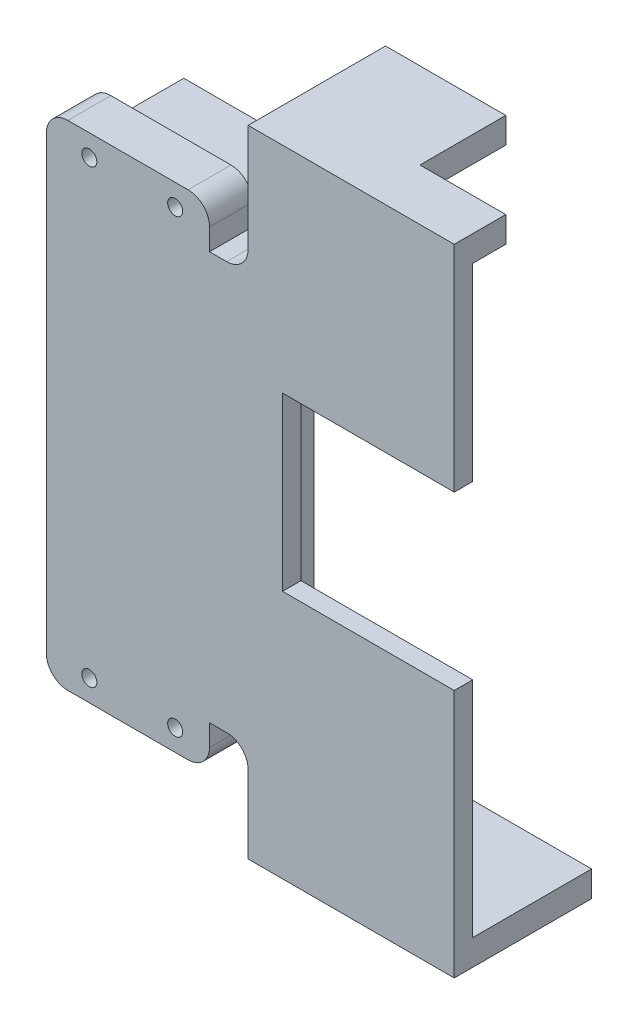
from build123d import *

# Parameters (mm, degrees)
SKETCH_1_W                = 130
SKETCH_1_H                = 64
EXTRUDE_1_DEPTH           = 125
SKETCH_2_W                = 55.4
SKETCH_2_H                = 114
CUT_EXTRUDE_1_DEPTH       = 47
SKETCH_3_W                = 45.4
SKETCH_3_H                = 86
CUT_EXTRUDE_2_DEPTH       = 78
SKETCH_4_W                = 24.038907643
SKETCH_4_H                = 40
CUT_EXTRUDE_3_DEPTH       = 40
SKETCH_5_W                = 4.3
SKETCH_5_H                = 25
CUT_EXTRUDE_4_DEPTH       = 25
SKETCH_6_W                = 10
SKETCH_6_H                = 40
CUT_EXTRUDE_5_DEPTH       = 35
SKETCH_9_W                = 5
SKETCH_9_H                = 125
CUT_EXTRUDE_8_DEPTH       = 155.744951452
SKETCH_10_W               = 20
SKETCH_10_H               = 150
EXTRUDE_2_DEPTH           = 5
SKETCH_11_R               = 2.5
CUT_EXTRUDE_9_DEPTH       = 159.941026799
FILLET_1_R                = 3
SKETCH_12_W               = 32
SKETCH_12_H               = 30
CUT_EXTRUDE_10_DEPTH      = 161.864073055
SKETCH_13_W               = 45
SKETCH_13_H               = 50
CUT_EXTRUDE_11_DEPTH      = 30
FILLET_5_R                = 5
SKETCH_14_W               = 32
SKETCH_14_H               = 150
CUT_EXTRUDE_12_DEPTH      = 185.946613919
SKETCH_16_W               = 14.899109585
SKETCH_16_H               = 40
CUT_EXTRUDE_14_DEPTH      = 40
CUT_EXTRUDE_15_DEPTH      = 143.707007536
CUT_EXTRUDE_15_DEPTH_BACK = 143.707007536
SKETCH_17_W               = 30
SKETCH_17_H               = 95
SKETCH_18_W               = 20
SKETCH_18_H               = 6
CUT_EXTRUDE_16_DEPTH      = 150.244765402
SKETCH_20_W               = 47
SKETCH_20_H               = 10
EXTRUDE_3_DEPTH           = 10
SKETCH_21_R               = 1.75
CUT_EXTRUDE_17_DEPTH      = 141.388745988
SKETCH_23_W               = 42
SKETCH_23_H               = 27.7
CUT_EXTRUDE_19_DEPTH      = 138.927517197
EXTRUDE_4_DEPTH           = 27.7
SKETCH_25_W               = 48
SKETCH_25_H               = 23
EXTRUDE_5_DEPTH           = 4.3
FILLET_6_R                = 5
FILLET_8_R                = 5
CUT_EXTRUDE_23_DEPTH      = 10
SKETCH_31_R               = 1.55
CUT_EXTRUDE_24_DEPTH      = 138.669895039
FILLET_9_R                = 5
FILLET_10_R               = 5
FILLET_11_R               = 5


with BuildPart() as part:
    # 草图1 → 凸台-拉伸1 (new body)
    with BuildSketch(Plane(origin=(0, 0, 0), x_dir=(1, 0, 0), z_dir=(0, 1, 0))):
        Rectangle(SKETCH_1_W, SKETCH_1_H)
    extrude(amount=EXTRUDE_1_DEPTH)

    # 草图2 → 切除-拉伸1 (cut)
    with BuildSketch(Plane(origin=(65, 0, 0), x_dir=(0, 0, -1), z_dir=(1, 0, 0))):
        with Locations((0, 62)):
            Rectangle(SKETCH_2_W, SKETCH_2_H)
    extrude(amount=-CUT_EXTRUDE_1_DEPTH, mode=Mode.SUBTRACT)

    # 草图3 → 切除-拉伸2 (cut)
    with BuildSketch(Plane(origin=(18, 0, 0), x_dir=(0, 0, -1), z_dir=(1, 0, 0))):
        with Locations((0, 48)):
            Rectangle(SKETCH_3_W, SKETCH_3_H)
    extrude(amount=-CUT_EXTRUDE_2_DEPTH, mode=Mode.SUBTRACT)

    # 草图4 → 切除-拉伸3 (cut)
    with BuildSketch(Plane(origin=(65, 0, 0), x_dir=(0, 0, -1), z_dir=(1, 0, 0))):
        with Locations((26.569318974, 55)):
            Rectangle(SKETCH_4_W, SKETCH_4_H)
    extrude(amount=-CUT_EXTRUDE_3_DEPTH, mode=Mode.SUBTRACT)

    # 草图5 → 切除-拉伸4 (cut)
    with BuildSketch(Plane(origin=(65, 0, 0), x_dir=(0, 0, -1), z_dir=(1, 0, 0))):
        with Locations((29.85, 87.5)):
            Rectangle(SKETCH_5_W, SKETCH_5_H)
    extrude(amount=-CUT_EXTRUDE_4_DEPTH, mode=Mode.SUBTRACT)

    # 草图6 → 切除-拉伸5 (cut)
    with BuildSketch(Plane(origin=(0, 125, 0), x_dir=(1, 0, 0), z_dir=(0, 1, 0))):
        with Locations((45, 0)):
            Rectangle(SKETCH_6_W, SKETCH_6_H)
    extrude(amount=-CUT_EXTRUDE_5_DEPTH, mode=Mode.SUBTRACT)

    # 草图9 → 切除-拉伸8 (cut, through all)
    with BuildSketch(Plane.XY.offset(32)):
        with Locations((62.5, 62.5)):
            Rectangle(SKETCH_9_W, SKETCH_9_H)
    extrude(amount=-CUT_EXTRUDE_8_DEPTH, mode=Mode.SUBTRACT)

    # 草图10 → 凸台-拉伸2 (add)
    with BuildSketch(Plane(origin=(0, 0, -32), x_dir=(-1, 0, 0), z_dir=(0, 0, -1))):
        with Locations((15, 57.5)):
            Rectangle(SKETCH_10_W, SKETCH_10_H)
    extrude(amount=-EXTRUDE_2_DEPTH)

    # 草图11 → 切除-拉伸9 (cut, through all)
    with BuildSketch(Plane.XY.offset(-27)):
        with Locations((-15, -12)):
            Circle(SKETCH_11_R)
        with Locations((-15, 137)):
            Circle(SKETCH_11_R)
    extrude(amount=-CUT_EXTRUDE_9_DEPTH, mode=Mode.SUBTRACT)

    # 圆角1
    fillet_1_edges = [part.edges().sort_by_distance(p)[0] for p in [
        (-15, 0, -27),
        (-5, 0, -29.5),
        (-25, 0, -29.5),
        (-25, 132.5, -29.5),
        (-25, 125, -29.5),
        (-5, 125, -29.5),
        (-15, 125, -27),
        (-25, -17.5, -29.5),
        (-5, -17.5, -29.5),
        (-5, 132.5, -29.5),
    ]]
    fillet(fillet_1_edges, radius=FILLET_1_R)

    # 草图12 → 切除-拉伸10 (cut, through all)
    with BuildSketch(Plane.XY.offset(32)):
        with Locations((-49, 110)):
            Rectangle(SKETCH_12_W, SKETCH_12_H)
    extrude(amount=-CUT_EXTRUDE_10_DEPTH, mode=Mode.SUBTRACT)

    # 草图13 → 切除-拉伸11 (cut)
    with BuildSketch(Plane(origin=(0, 125, 0), x_dir=(1, 0, 0), z_dir=(0, 1, 0))):
        with Locations((-10.5, -7)):
            Rectangle(SKETCH_13_W, SKETCH_13_H)
    extrude(amount=-CUT_EXTRUDE_11_DEPTH, mode=Mode.SUBTRACT)

    # 圆角5
    fillet_5_edges = [part.edges().sort_by_distance(p)[0] for p in [
        (-33, 110, -18),
        (12, 110, -18),
    ]]
    fillet(fillet_5_edges, radius=FILLET_5_R)

    # 草图14 → 切除-拉伸12 (cut, through all)
    with BuildSketch(Plane.ZY.offset(65)):
        with Locations((-16, 57.5)):
            Rectangle(SKETCH_14_W, SKETCH_14_H)
    extrude(amount=-CUT_EXTRUDE_12_DEPTH, mode=Mode.SUBTRACT)

    # 草图16 → 切除-拉伸14 (cut)
    with BuildSketch(Plane(origin=(60, 0, 0), x_dir=(0, 0, -1), z_dir=(1, 0, 0))):
        with Locations((-29.056746571, 55)):
            Rectangle(SKETCH_16_W, SKETCH_16_H)
    extrude(amount=-CUT_EXTRUDE_14_DEPTH, mode=Mode.SUBTRACT)

    # 草图17 → 切除-拉伸15 (cut, two sides: drawn at the far end of the back side and taken through both)
    with BuildSketch(Plane(origin=(0, 0, 22.7), x_dir=(-1, 0, 0), z_dir=(0, 0, -1)).offset(-CUT_EXTRUDE_15_DEPTH_BACK)):
        with Locations((50, 47.5)):
            Rectangle(SKETCH_17_W, SKETCH_17_H)
    extrude(amount=CUT_EXTRUDE_15_DEPTH + CUT_EXTRUDE_15_DEPTH_BACK, mode=Mode.SUBTRACT)

    # 草图18 → 切除-拉伸16 (cut, through all)
    with BuildSketch(Plane(origin=(40, 0, 0), x_dir=(0, 0, -1), z_dir=(1, 0, 0))):
        with Locations((-10, 122)):
            Rectangle(SKETCH_18_W, SKETCH_18_H)
    extrude(amount=CUT_EXTRUDE_16_DEPTH, mode=Mode.SUBTRACT)

    # 草图20 → 凸台-拉伸3 (add)
    with BuildSketch(Plane.XY.offset(32)):
        with Locations((-11.5, -5)):
            Rectangle(SKETCH_20_W, SKETCH_20_H)
        with Locations((-11.5, 100)):
            Rectangle(SKETCH_20_W, SKETCH_20_H)
    extrude(amount=-EXTRUDE_3_DEPTH)

    # 草图21 → 切除-拉伸17 (cut, through all)
    with BuildSketch(Plane(origin=(0, 0, 22), x_dir=(-1, 0, 0), z_dir=(0, 0, -1))):
        with Locations(Location((25, -5, 0), (0, 0, 180))):
            Circle(SKETCH_21_R)
        with Locations(Location((5, -5, 0), (0, 0, 180))):
            Circle(SKETCH_21_R)
        with Locations((5, 100)):
            Circle(SKETCH_21_R)
        with Locations((25, 100)):
            Circle(SKETCH_21_R)
    extrude(amount=-CUT_EXTRUDE_17_DEPTH, mode=Mode.SUBTRACT)

    # 草图23 → 切除-拉伸19 (cut, through all)
    with BuildSketch(Plane(origin=(0, 5, 0), x_dir=(1, 0, 0), z_dir=(0, 1, 0))):
        with Locations((39, -13.85)):
            Rectangle(SKETCH_23_W, SKETCH_23_H)
    extrude(amount=-CUT_EXTRUDE_19_DEPTH, mode=Mode.SUBTRACT)

    # 草图24 → 凸台-拉伸4 (add)
    with BuildSketch(Plane(origin=(0, 0, 0), x_dir=(-1, 0, 0), z_dir=(0, 0, -1))):
        Polygon((-18, 0), (-18, -17), (-60, -17), (-60, -23), (-12, -23), (-12, 0), align=None)
    extrude(amount=-EXTRUDE_4_DEPTH)

    # 草图25 → 凸台-拉伸5 (add)
    with BuildSketch(Plane.XY.offset(32)):
        with Locations((36, -11.5)):
            Rectangle(SKETCH_25_W, SKETCH_25_H)
    extrude(amount=-EXTRUDE_5_DEPTH)

    # 圆角6
    fillet_6_edges = [part.edges().sort_by_distance(p)[0] for p in [
        (-35, 105, 27),
        (12, 105, 27),
        (-35, -10, 27),
        (12, -10, 27),
    ]]
    fillet(fillet_6_edges, radius=FILLET_6_R)

    # 圆角8
    fillet_8_edges = [part.edges().sort_by_distance(p)[0] for p in [
        (12, 95, 11),
    ]]
    fillet(fillet_8_edges, radius=FILLET_8_R)

    # 草图30 → 切除-拉伸23 (cut)
    with BuildSketch(Plane(origin=(0, 0, 22), x_dir=(-1, 0, 0), z_dir=(0, 0, -1))):
        with BuildLine():
            Line((-7, 105), (-3, 105))
            Line((-3, 105), (-3, 95))
            Line((-3, 95), (-7, 95))
            ThreePointArc((-7, 95), (-10.535533906, 96.464466094), (-12, 100))
            Line((-12, 100), (-12, 110))
            ThreePointArc((-12, 110), (-10.535533906, 106.464466094), (-7, 105))
        make_face()
        with BuildLine():
            Line((-7, -10), (-3, -10))
            Line((-3, -10), (-3, 0))
            Line((-3, 0), (-12, 0))
            Line((-12, 0), (-12, -15))
            ThreePointArc((-12, -15), (-10.535533906, -11.464466094), (-7, -10))
        make_face()
    extrude(amount=-CUT_EXTRUDE_23_DEPTH, mode=Mode.SUBTRACT)

    # 草图31 → 切除-拉伸24 (cut, through all)
    with BuildSketch(Plane.ZY.offset(-12)):
        with Locations(Location((23.7, 113.3, 0), (0, 0, 270))):
            Circle(SKETCH_31_R)
        with Locations(Location((23.7, -12.3, 0), (0, 0, 270))):
            Circle(SKETCH_31_R)
    extrude(amount=-CUT_EXTRUDE_24_DEPTH, mode=Mode.SUBTRACT)

    # 圆角9
    fillet_9_edges = [part.edges().sort_by_distance(p)[0] for p in [
        (12, 0, 16),
    ]]
    fillet(fillet_9_edges, radius=FILLET_9_R)

    # 圆角10
    fillet_10_edges = [part.edges().sort_by_distance(p)[0] for p in [
        (3, -10, 27),
    ]]
    fillet(fillet_10_edges, radius=FILLET_10_R)

    # 圆角11
    fillet_11_edges = [part.edges().sort_by_distance(p)[0] for p in [
        (3, 105, 27),
    ]]
    fillet(fillet_11_edges, radius=FILLET_11_R)


solid = part.part
